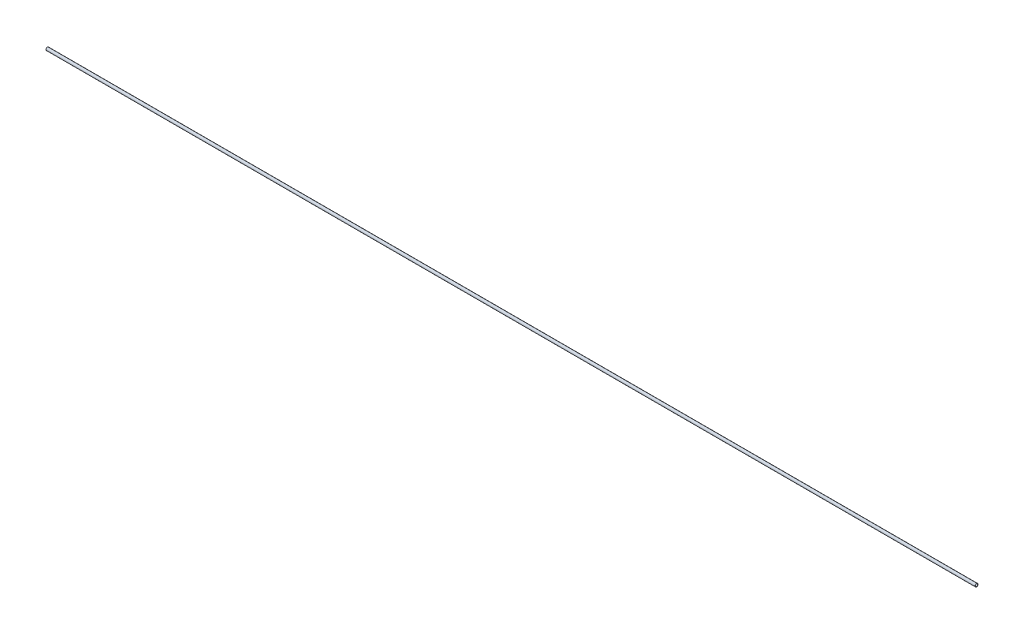
from build123d import *

# Parameters (mm, degrees)
SKETCH1_R           = 1.905
BOSS_EXTRUDE1_DEPTH = 1219.2
SKETCH2_R           = 1.5875
CUT_EXTRUDE1_DEPTH  = 1220.202976559


with BuildPart() as part:
    # Sketch1 → Boss-Extrude1 (new body)
    with BuildSketch(Plane(origin=(0, 0, 0), x_dir=(0, 0, -1), z_dir=(1, 0, 0))):
        with Locations(Location((0, 0, 0), (0, 0, 180))):
            Circle(SKETCH1_R)
    extrude(amount=BOSS_EXTRUDE1_DEPTH)

    # Sketch2 → Cut-Extrude1 (cut, through all)
    with BuildSketch(Plane.ZY):
        Circle(SKETCH2_R)
    extrude(amount=-CUT_EXTRUDE1_DEPTH, mode=Mode.SUBTRACT)


solid = part.part
